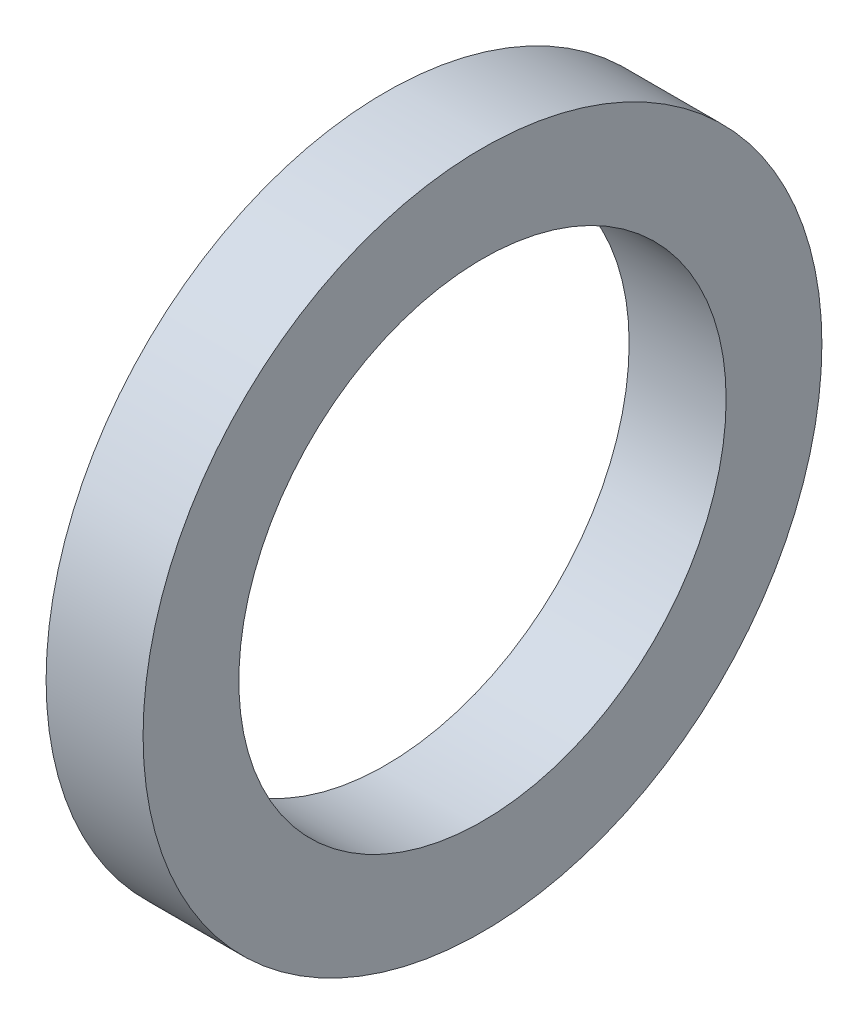
from build123d import *

# Parameters (mm, degrees)
SKETCH1_R           = 14
SKETCH1_R_2         = 10.05
BOSS_EXTRUDE1_DEPTH = 4


with BuildPart() as part:
    # Sketch1 → Boss-Extrude1 (new body)
    with BuildSketch(Plane(origin=(0, 0, 0), x_dir=(0, 0, -1), z_dir=(1, 0, 0))):
        Circle(SKETCH1_R)
        Circle(SKETCH1_R_2, mode=Mode.SUBTRACT)
    extrude(amount=BOSS_EXTRUDE1_DEPTH)


solid = part.part
